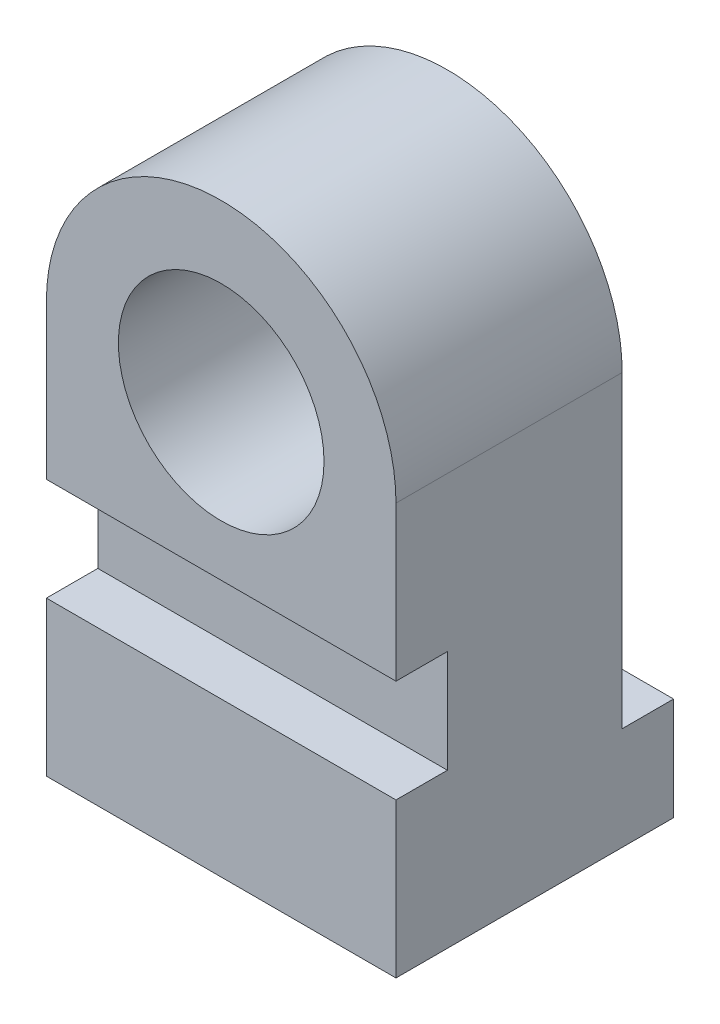
from build123d import *

# Parameters (mm, degrees)
SKETCH1_R           = 10000
BOSS_EXTRUDE1_DEPTH = 22000
SKETCH2_W           = 34000
SKETCH2_H           = 10000
CUT_EXTRUDE1_DEPTH  = 5000
SKETCH3_W           = 34000
SKETCH3_H           = 10000
BOSS_EXTRUDE2_DEPTH = 5000


with BuildPart() as part:
    # Sketch1 → Boss-Extrude1 (new body)
    with BuildSketch(Plane.XY):
        with BuildLine():
            Line((-17000, 0), (17000, 0))
            Line((17000, 0), (17000, 40000))
            ThreePointArc((17000, 40000), (0, 57000), (-17000, 40000))
            Line((-17000, 40000), (-17000, 0))
        make_face()
        with Locations((0, 40000)):
            Circle(SKETCH1_R, mode=Mode.SUBTRACT)
    extrude(amount=BOSS_EXTRUDE1_DEPTH)

    # Sketch2 → Cut-Extrude1 (cut)
    with BuildSketch(Plane.XY.offset(22000)):
        with Locations((0, 20000)):
            Rectangle(SKETCH2_W, SKETCH2_H)
    extrude(amount=-CUT_EXTRUDE1_DEPTH, mode=Mode.SUBTRACT)

    # Sketch3 → Boss-Extrude2 (add)
    with BuildSketch(Plane(origin=(0, 0, 0), x_dir=(-1, 0, 0), z_dir=(0, 0, -1))):
        with Locations((0, 5000)):
            Rectangle(SKETCH3_W, SKETCH3_H)
    extrude(amount=BOSS_EXTRUDE2_DEPTH)


solid = part.part
